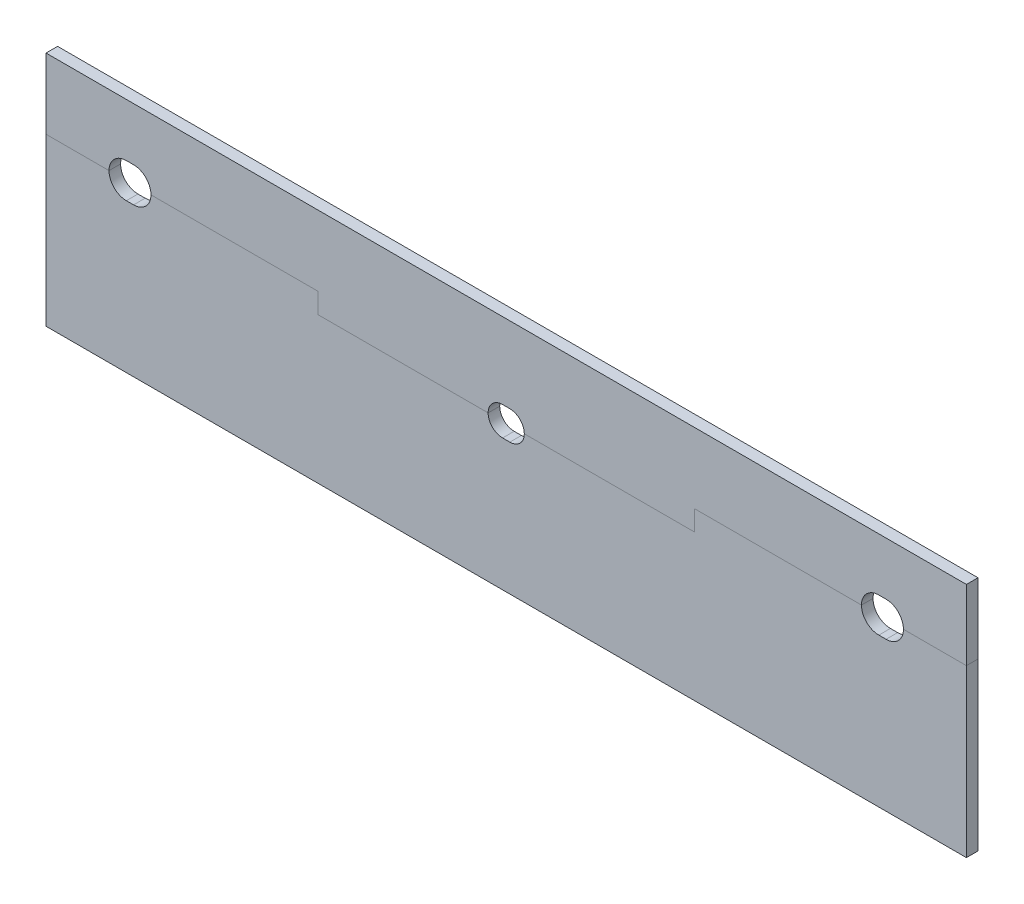
from build123d import *

# Parameters (mm, degrees)
SKETCH1_W                = 81.76788233
SKETCH1_H                = 318.0385329
BOSS_EXTRUDE1_DEPTH      = 4
SPLIT1_SURFACE_1_1_BACK  = 329.406
SPLIT1_SURFACE_1_1_DEPTH = 658.812
SPLIT1_SURFACE_1_2_BACK  = 329.406
SPLIT1_SURFACE_1_2_DEPTH = 658.812


with BuildPart() as part:
    # Sketch1 → Boss-Extrude1 (new body)
    with BuildSketch(Plane(origin=(0, 0, 0), x_dir=(0, 1, 0), z_dir=(0, 0, 1))):
        with Locations((-16.57951628, 0)):
            Rectangle(SKETCH1_W, SKETCH1_H)
        with BuildLine():
            Line((-6, 128.75), (-6, 131.25))
            ThreePointArc((-6, 131.25), (0, 137.25), (6, 131.25))
            Line((6, 131.25), (6, 128.75))
            ThreePointArc((6, 128.75), (0, 122.75), (-6, 128.75))
        make_face(mode=Mode.SUBTRACT)
        with BuildLine():
            Line((-6, -131.25), (-6, -128.75))
            ThreePointArc((-6, -128.75), (0, -122.75), (6, -128.75))
            Line((6, -128.75), (6, -131.25))
            ThreePointArc((6, -131.25), (0, -137.25), (-6, -131.25))
        make_face(mode=Mode.SUBTRACT)
        with BuildLine():
            Line((-2, 1.25), (-2, -1.25))
            ThreePointArc((-2, -1.25), (-7, -6.25), (-12, -1.25))
            Line((-12, -1.25), (-12, 1.25))
            ThreePointArc((-12, 1.25), (-7, 6.25), (-2, 1.25))
        make_face(mode=Mode.SUBTRACT)
    extrude(amount=BOSS_EXTRUDE1_DEPTH)


with BuildPart() as body_2:
    # Split1: the piece behind the surface
    add(part.part)
    # Split1 surface 1: a surface, the sketch's curves swept straight by 658.812 mm
    with BuildLine(Plane.XY.offset(4).offset(-SPLIT1_SURFACE_1_1_BACK), mode=Mode.PRIVATE) as split1_surface_1_1_path:
        Line((159.01926645, 0), (65, 0))
        Line((65, 0), (65, -7))
        Line((65, -7), (-65, -7))
        Line((-65, -7), (-65, 0))
        Line((-65, 0), (-159.01926645, 0))
    split1_surface_1_1 = Shell.extrude(split1_surface_1_1_path.wire(), (0 * SPLIT1_SURFACE_1_1_DEPTH, 0 * SPLIT1_SURFACE_1_1_DEPTH, 1 * SPLIT1_SURFACE_1_1_DEPTH))
    split(bisect_by=split1_surface_1_1, keep=Keep.BOTTOM)


with BuildPart() as part_1:
    add(part.part)

    # Split1: split by a surface, the side it looks to stays
    # Split1 surface 1: a surface, the sketch's curves swept straight by 658.812 mm
    with BuildLine(Plane.XY.offset(4).offset(-SPLIT1_SURFACE_1_2_BACK), mode=Mode.PRIVATE) as split1_surface_1_2_path:
        Line((159.01926645, 0), (65, 0))
        Line((65, 0), (65, -7))
        Line((65, -7), (-65, -7))
        Line((-65, -7), (-65, 0))
        Line((-65, 0), (-159.01926645, 0))
    split1_surface_1_2 = Shell.extrude(split1_surface_1_2_path.wire(), (0 * SPLIT1_SURFACE_1_2_DEPTH, 0 * SPLIT1_SURFACE_1_2_DEPTH, 1 * SPLIT1_SURFACE_1_2_DEPTH))
    split(bisect_by=split1_surface_1_2, keep=Keep.TOP)


solid = Compound([body_2.part, part_1.part])
